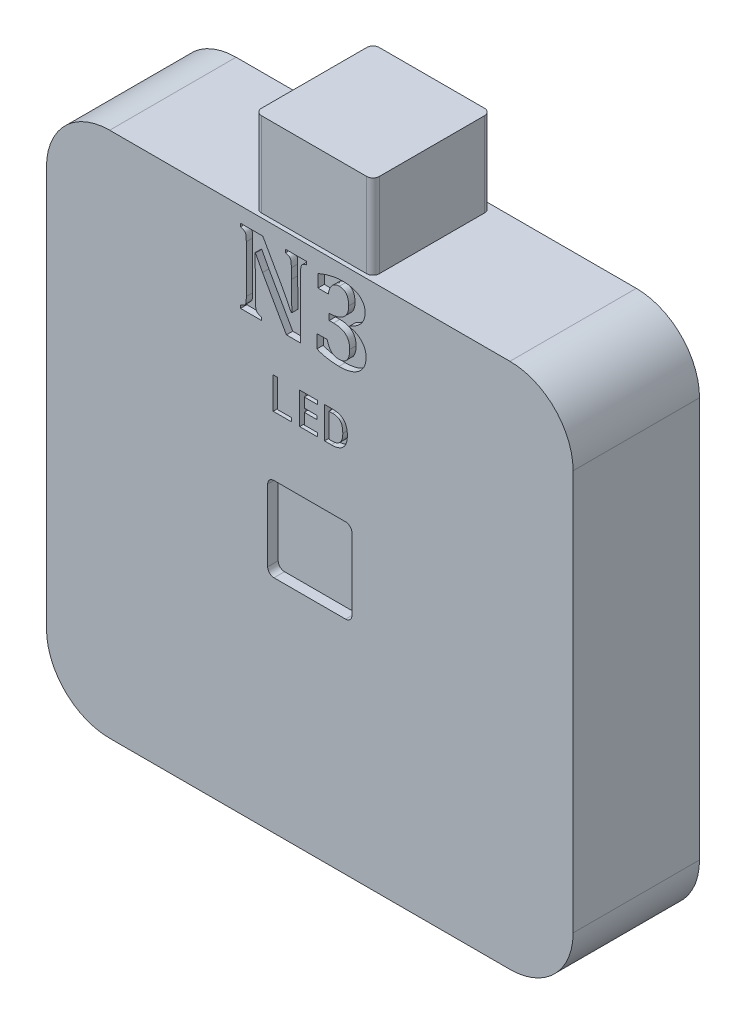
from build123d import *

# Parameters (mm, degrees)
EXTRUDE_1_DEPTH     = 3
CUT_EXTRUDE_2_DEPTH = 0.5
CUT_EXTRUDE_3_DEPTH = 0.3
EXTRUDE_2_DEPTH     = 4
CUT_EXTRUDE_4_DEPTH = 5


with BuildPart() as part:
    # Main → 凸台-拉伸1 (new, symmetric)
    with BuildSketch(Plane.XY):
        with BuildLine():
            Line((-12.5, 9.5), (-12.5, -9.5))
            ThreePointArc((-12.5, -9.5), (-11.621320344, -11.621320344), (-9.5, -12.5))
            Line((-9.5, -12.5), (9.5, -12.5))
            ThreePointArc((9.5, -12.5), (11.621320344, -11.621320344), (12.5, -9.5))
            Line((12.5, -9.5), (12.5, 9.5))
            ThreePointArc((12.5, 9.5), (11.621320344, 11.621320344), (9.5, 12.5))
            Line((9.5, 12.5), (-9.5, 12.5))
            ThreePointArc((-9.5, 12.5), (-11.621320344, 11.621320344), (-12.5, 9.5))
        make_face()
    extrude(amount=EXTRUDE_1_DEPTH, both=True)

    # LED → 切除-拉伸2 (cut)
    with BuildSketch(Plane.XY.offset(3)):
        with BuildLine():
            Line((-2, 1.7), (-2, -1.7))
            ThreePointArc((-2, -1.7), (-1.912132034, -1.912132034), (-1.7, -2))
            Line((-1.7, -2), (1.7, -2))
            ThreePointArc((1.7, -2), (1.912132034, -1.912132034), (2, -1.7))
            Line((2, -1.7), (2, 1.7))
            ThreePointArc((2, 1.7), (1.912132034, 1.912132034), (1.7, 2))
            Line((1.7, 2), (-1.7, 2))
            ThreePointArc((-1.7, 2), (-1.912132034, 1.912132034), (-2, 1.7))
        make_face()
    extrude(amount=-CUT_EXTRUDE_2_DEPTH, mode=Mode.SUBTRACT)

    # 草图3 → 切除-拉伸3 (cut)
    # profile 1 of 5: a face of its own
    with BuildSketch(Plane.XY.offset(3)):
        with BuildLine():
            Line((-0.161653646, 11.781109518), (-0.161653646, 11.635276185))
            add(Edge.make_bspline(
                [(-0.161653646, 11.635276185), (-0.177669577, 11.630143703), (-0.207122243, 11.62070527), (-0.246900488, 11.605079733), (-0.279469724, 11.591737774), (-0.312906932, 11.575932284), (-0.347427448, 11.553100688), (-0.382321405, 11.516267884), (-0.408955266, 11.463747633), (-0.422918392, 11.407823862), (-0.431549055, 11.351158658), (-0.435554473, 11.295811772), (-0.438778121, 11.230222428), (-0.438850306, 11.182844202), (-0.438888889, 11.157520108)],
                knots=[0, 0, 0, 0, 0.975471235, 1.79385316, 2.478592115, 3.017303699, 3.938041953, 4.862988783, 5.927517867, 7.313751775, 8.190433857, 9.251714942, 10.531016607, 12, 12, 12, 12], degree=3))
            Line((-0.438888889, 11.157520108), (-0.438888889, 8.281109518))
            Line((-0.438888889, 8.281109518), (-1.109570312, 8.281109518))
            Line((-1.109570312, 8.281109518), (-2.243576389, 10.276443719))
            add(Edge.make_bspline(
                [(-2.243576389, 10.276443719), (-2.262061977, 10.30935546), (-2.297864844, 10.373098887), (-2.349981257, 10.466014814), (-2.397397164, 10.553857645), (-2.44170538, 10.636006813), (-2.48201379, 10.712701344), (-2.518234642, 10.783968671), (-2.551426649, 10.84954286), (-2.571291416, 10.891884411), (-2.580815972, 10.912185907)],
                knots=[0, 0, 0, 0, 1.258598321, 2.437651948, 3.551981321, 4.586832213, 5.549698172, 6.440681917, 7.252354063, 8, 8, 8, 8], degree=3))
            Line((-2.580815972, 10.912185907), (-2.603602431, 10.912185907))
            add(Edge.make_bspline(
                [(-2.603602431, 10.912185907), (-2.599591716, 10.81800995), (-2.59147488, 10.627417745), (-2.583113042, 10.337504552), (-2.578672736, 10.039985491), (-2.578078581, 9.838945123), (-2.577777778, 9.737164205)],
                knots=[0, 0, 0, 0, 0.96232484, 1.947541814, 2.960899847, 4, 4, 4, 4], degree=3))
            Line((-2.577777778, 9.737164205), (-2.577777778, 8.90317983))
            add(Edge.make_bspline(
                [(-2.577777778, 8.90317983), (-2.577360248, 8.873305826), (-2.576592183, 8.81835119), (-2.574303843, 8.743023002), (-2.568298325, 8.682170292), (-2.558638799, 8.621966077), (-2.535177858, 8.562565398), (-2.499072994, 8.513092269), (-2.457295753, 8.483552474), (-2.414642197, 8.463699144), (-2.361461312, 8.444163617), (-2.321902365, 8.432980934), (-2.300542535, 8.426942851)],
                knots=[0, 0, 0, 0, 1.438978439, 2.647068478, 3.627372042, 4.383140196, 5.576371536, 6.671434312, 7.273846566, 8.020909247, 8.931391092, 10, 10, 10, 10], degree=3))
            Line((-2.300542535, 8.426942851), (-2.300542535, 8.281109518))
            Line((-2.300542535, 8.281109518), (-3.289474826, 8.281109518))
            Line((-3.289474826, 8.281109518), (-3.289474826, 8.426942851))
            add(Edge.make_bspline(
                [(-3.289474826, 8.426942851), (-3.260887566, 8.435405948), (-3.209575028, 8.450596734), (-3.141898216, 8.480225141), (-3.089109373, 8.517166522), (-3.054582463, 8.569155916), (-3.031805913, 8.631573888), (-3.021267721, 8.708155169), (-3.015577407, 8.800531184), (-3.015384102, 8.86822464), (-3.015277778, 8.905458476)],
                knots=[0, 0, 0, 0, 1.149089374, 2.062551405, 2.843955622, 3.594533422, 4.429073491, 5.389328747, 6.564036866, 8, 8, 8, 8], degree=3))
            Line((-3.015277778, 8.905458476), (-3.015277778, 11.15676056))
            add(Edge.make_bspline(
                [(-3.015277778, 11.15676056), (-3.015325243, 11.186892755), (-3.015411829, 11.241859483), (-3.018334, 11.316860805), (-3.023087242, 11.376518256), (-3.032403199, 11.435206702), (-3.054104254, 11.494869379), (-3.091783318, 11.544237582), (-3.134117609, 11.575394999), (-3.176190741, 11.598027263), (-3.229205053, 11.618124618), (-3.268362891, 11.629268152), (-3.289474826, 11.635276185)],
                knots=[0, 0, 0, 0, 1.453211759, 2.650928568, 3.61941141, 4.338124492, 5.512963293, 6.643955544, 7.271627919, 8.036671964, 8.941472357, 10, 10, 10, 10], degree=3))
            Line((-3.289474826, 11.635276185), (-3.289474826, 11.781109518))
            Line((-3.289474826, 11.781109518), (-2.231423611, 11.781109518))
            Line((-2.231423611, 11.781109518), (-1.341232639, 10.204286601))
            add(Edge.make_bspline(
                [(-1.341232639, 10.204286601), (-1.326281235, 10.177203726), (-1.29419107, 10.119075811), (-1.242753958, 10.025182062), (-1.186516622, 9.917693152), (-1.103399271, 9.760024352), (-1.000819197, 9.561493992), (-0.925038386, 9.400153632), (-0.888541667, 9.322450664)],
                knots=[0, 0, 0, 0, 0.561655796, 1.205480602, 1.943652644, 2.764033489, 4.441529425, 6, 6, 6, 6], degree=3))
            Line((-0.888541667, 9.322450664), (-0.84828559, 9.322450664))
            add(Edge.make_bspline(
                [(-0.84828559, 9.322450664), (-0.852568567, 9.42801973), (-0.86132807, 9.643928572), (-0.870286692, 9.974860117), (-0.875728167, 10.319972333), (-0.876165667, 10.554689597), (-0.876388889, 10.674447192)],
                knots=[0, 0, 0, 0, 0.937488971, 1.917343447, 2.937385629, 4, 4, 4, 4], degree=3))
            Line((-0.876388889, 10.674447192), (-0.876388889, 11.156001011))
            add(Edge.make_bspline(
                [(-0.876388889, 11.156001011), (-0.8765491, 11.182077908), (-0.876846263, 11.230445989), (-0.878584804, 11.297370597), (-0.88341317, 11.352551665), (-0.889470731, 11.40804868), (-0.902414163, 11.461838736), (-0.926402611, 11.513437364), (-0.960023933, 11.5513147), (-0.994463834, 11.575841901), (-1.029168865, 11.592604982), (-1.062773812, 11.606857189), (-1.104258254, 11.621111424), (-1.134351907, 11.630312605), (-1.150585937, 11.635276185)],
                knots=[0, 0, 0, 0, 1.50660748, 2.794493175, 3.865833101, 4.705810794, 6.018377177, 7.045366401, 7.95762345, 8.91149549, 9.467497486, 10.181957038, 11.019256184, 12, 12, 12, 12], degree=3))
            Line((-1.150585937, 11.635276185), (-1.150585937, 11.781109518))
            Line((-1.150585937, 11.781109518), (-0.161653646, 11.781109518))
        make_face()
    # profile 2 of 5: a face of its own
    with BuildSketch(Plane.XY.offset(3)):
        with BuildLine():
            Line((0.3875, 10.954720629), (0.3875, 11.55552358))
            add(Edge.make_bspline(
                [(0.3875, 11.55552358), (0.440740019, 11.577509227), (0.544910562, 11.620526806), (0.701382153, 11.67600796), (0.853924181, 11.723162671), (1.002588814, 11.762188687), (1.147644136, 11.791995458), (1.288859262, 11.813238903), (1.426551741, 11.826815623), (1.517172623, 11.82876262), (1.561762153, 11.829720629)],
                knots=[0, 0, 0, 0, 1.138871734, 2.228340433, 3.281437788, 4.295392059, 5.266464412, 6.20817041, 7.11833965, 8, 8, 8, 8], degree=3))
            add(Edge.make_bspline(
                [(1.561762153, 11.829720629), (1.612700862, 11.828818436), (1.711831349, 11.827062702), (1.855946997, 11.810043084), (1.991078637, 11.782324938), (2.116218264, 11.742896491), (2.230784195, 11.693991601), (2.332778472, 11.634502441), (2.419627815, 11.562468262), (2.493671249, 11.481886216), (2.55197375, 11.390384121), (2.594306505, 11.289862871), (2.619025084, 11.17971571), (2.62204951, 11.103465747), (2.623611111, 11.064095629)],
                knots=[0, 0, 0, 0, 1.245991689, 2.424791773, 3.545045706, 4.616816666, 5.629595787, 6.587952593, 7.494614438, 8.380594144, 9.255347842, 10.135547138, 11.037327689, 12, 12, 12, 12], degree=3))
            add(Edge.make_bspline(
                [(2.623611111, 11.064095629), (2.622735968, 11.028066694), (2.621031018, 10.957875282), (2.60351275, 10.856007142), (2.57681259, 10.760264172), (2.537203389, 10.67174744), (2.48900985, 10.589026607), (2.431899461, 10.51188363), (2.364854414, 10.440894183), (2.289034787, 10.374315574), (2.202470426, 10.311815885), (2.105401044, 10.250288114), (1.996821144, 10.188580227), (1.91897061, 10.150440372), (1.878493924, 10.130610386)],
                knots=[0, 0, 0, 0, 1.018223358, 1.983698243, 2.915322269, 3.82284993, 4.718315375, 5.619291428, 6.531357531, 7.475260989, 8.469397413, 9.548207294, 10.725243872, 12, 12, 12, 12], degree=3))
            Line((1.878493924, 10.130610386), (1.878493924, 10.107823928))
            add(Edge.make_bspline(
                [(1.878493924, 10.107823928), (1.914332461, 10.100573361), (1.985268492, 10.086222149), (2.088345737, 10.054417236), (2.185825078, 10.011929471), (2.278699343, 9.962321579), (2.364496749, 9.903470268), (2.441580147, 9.834864416), (2.509481243, 9.757209764), (2.567266491, 9.670081548), (2.614853742, 9.575293169), (2.648343733, 9.472147921), (2.668374432, 9.361713423), (2.670917252, 9.285571619), (2.672222222, 9.246495803)],
                knots=[0, 0, 0, 0, 1.026010526, 2.030805963, 3.020916541, 4.0067071, 4.98253303, 5.933933234, 6.895997563, 7.869724968, 8.861364754, 9.863719257, 10.903665134, 12, 12, 12, 12], degree=3))
            add(Edge.make_bspline(
                [(2.672222222, 9.246495803), (2.670475833, 9.198772508), (2.66704771, 9.105092709), (2.639892184, 8.96867947), (2.594916044, 8.840381305), (2.541926714, 8.741209427), (2.491221993, 8.666758497), (2.448082435, 8.614099673), (2.400660821, 8.563973017), (2.347753383, 8.517937264), (2.291156171, 8.473615925), (2.229135573, 8.433475264), (2.162916446, 8.396210352), (2.067455524, 8.350000016), (1.936808858, 8.301935023), (1.766553096, 8.261373754), (1.580692314, 8.237026181), (1.451703991, 8.234044991), (1.384787326, 8.232498407)],
                knots=[0, 0, 0, 0, 1.238691166, 2.431524098, 3.596131476, 4.758044184, 5.339846471, 5.93341988, 6.524072501, 7.129652346, 7.75306838, 8.389559096, 9.046112197, 9.725450149, 11.142277535, 12.650970423, 14.262587788, 16, 16, 16, 16], degree=3))
            add(Edge.make_bspline(
                [(1.384787326, 8.232498407), (1.33716922, 8.233000944), (1.242335341, 8.234001772), (1.100704382, 8.244589066), (0.960201974, 8.260012504), (0.822458508, 8.283105417), (0.689307329, 8.310166445), (0.564478721, 8.345095257), (0.447273325, 8.381722131), (0.374357917, 8.413166248), (0.338888889, 8.428461949)],
                knots=[0, 0, 0, 0, 1.066585531, 2.124159315, 3.180226203, 4.232065357, 5.252166273, 6.22223498, 7.135222593, 8, 8, 8, 8], degree=3))
            Line((0.338888889, 8.428461949), (0.338888889, 9.058887296))
            Line((0.338888889, 9.058887296), (0.825, 9.058887296))
            add(Edge.make_bspline(
                [(0.825, 9.058887296), (0.837189747, 9.015014079), (0.860202393, 8.932187192), (0.907565053, 8.819827773), (0.960730451, 8.725473619), (1.023417455, 8.650027003), (1.096067092, 8.592546026), (1.17921829, 8.55307138), (1.27189704, 8.527622129), (1.337265875, 8.52534449), (1.371115451, 8.524165074)],
                knots=[0, 0, 0, 0, 1.305930177, 2.46542516, 3.491309853, 4.404185451, 5.263440125, 6.128056862, 7.030662191, 8, 8, 8, 8], degree=3))
            add(Edge.make_bspline(
                [(1.371115451, 8.524165074), (1.392164121, 8.524433805), (1.433176166, 8.524957413), (1.492609065, 8.53390272), (1.548059007, 8.546568938), (1.599916425, 8.563781846), (1.646929411, 8.587859054), (1.690785253, 8.615684602), (1.729796272, 8.649783266), (1.765072714, 8.688559859), (1.795252278, 8.733144058), (1.822079278, 8.782170178), (1.84498521, 8.836294062), (1.86284081, 8.89598753), (1.877484799, 8.960655912), (1.886829861, 9.030567503), (1.893110212, 9.1053591), (1.893990014, 9.156854944), (1.894444444, 9.183453268)],
                knots=[0, 0, 0, 0, 1.04932923, 2.044553753, 2.991534269, 3.886518749, 4.762302477, 5.620875306, 6.471885114, 7.33961212, 8.229767994, 9.151377203, 10.125200033, 11.156267991, 12.256683227, 13.430583075, 14.672860224, 16, 16, 16, 16], degree=3))
            add(Edge.make_bspline(
                [(1.894444444, 9.183453268), (1.893923242, 9.212094329), (1.89291031, 9.267756915), (1.883337619, 9.348187978), (1.86974041, 9.423238576), (1.847881869, 9.491942686), (1.821530947, 9.555576976), (1.788878631, 9.613655138), (1.749657985, 9.66586494), (1.704456283, 9.71249025), (1.653392593, 9.753918462), (1.595481177, 9.788663397), (1.532454678, 9.819445748), (1.462480649, 9.84356268), (1.386682245, 9.862203917), (1.304717529, 9.876142531), (1.216545131, 9.883216945), (1.155667314, 9.884575397), (1.124262153, 9.885276185)],
                knots=[0, 0, 0, 0, 1.148071931, 2.231225072, 3.24480356, 4.201827953, 5.116438562, 6.003060875, 6.866114256, 7.727792825, 8.601530905, 9.494871905, 10.430378815, 11.409816751, 12.456422708, 13.558120058, 14.740302521, 16, 16, 16, 16], degree=3))
            Line((1.124262153, 9.885276185), (0.922222222, 9.885276185))
            Line((0.922222222, 9.885276185), (0.922222222, 10.176942851))
            add(Edge.make_bspline(
                [(0.922222222, 10.176942851), (0.958968977, 10.179047578), (1.030367567, 10.183137041), (1.133861524, 10.196149192), (1.23055265, 10.214228929), (1.320626575, 10.237464771), (1.403485769, 10.267000531), (1.479437046, 10.302240842), (1.548758592, 10.342427601), (1.611744672, 10.387864156), (1.666592564, 10.440159976), (1.714960843, 10.497177798), (1.755313557, 10.560217187), (1.789037602, 10.628097219), (1.814991128, 10.701808441), (1.832889709, 10.780828418), (1.84365028, 10.865304662), (1.845090515, 10.92329325), (1.845833333, 10.953201532)],
                knots=[0, 0, 0, 0, 1.294124326, 2.514471056, 3.665273782, 4.75157949, 5.782351101, 6.754339568, 7.691995305, 8.596689159, 9.478484644, 10.35060716, 11.219952716, 12.103948147, 13.010742687, 13.961079669, 14.948403386, 16, 16, 16, 16], degree=3))
            add(Edge.make_bspline(
                [(1.845833333, 10.953201532), (1.845601673, 10.976502984), (1.845150288, 11.021905495), (1.839954798, 11.087649363), (1.83057941, 11.148966268), (1.818822186, 11.205961214), (1.803003196, 11.258682836), (1.782835695, 11.306707618), (1.760733292, 11.351079808), (1.73337706, 11.389994358), (1.704254924, 11.425255015), (1.670709149, 11.455221946), (1.634583481, 11.481320037), (1.594305126, 11.501550057), (1.551844133, 11.518784688), (1.505510174, 11.529871196), (1.456147632, 11.536840966), (1.422030494, 11.537642794), (1.40453559, 11.538053962)],
                knots=[0, 0, 0, 0, 1.342415624, 2.615675512, 3.795773904, 4.914495864, 5.966655767, 6.960891649, 7.913479791, 8.815817395, 9.695585522, 10.542445334, 11.400538855, 12.255277765, 13.132987386, 14.03520706, 14.992475158, 16, 16, 16, 16], degree=3))
            add(Edge.make_bspline(
                [(1.40453559, 11.538053962), (1.384491939, 11.53754342), (1.344910756, 11.536535226), (1.286744903, 11.526292289), (1.230852682, 11.509562789), (1.177220657, 11.485709854), (1.12508323, 11.454589705), (1.077488635, 11.411845023), (1.032105503, 11.360106931), (0.989775583, 11.298597965), (0.951803541, 11.227101967), (0.920110747, 11.145095851), (0.892637928, 11.053754417), (0.880107507, 10.9885341), (0.873611111, 10.954720629)],
                knots=[0, 0, 0, 0, 0.831492998, 1.641990067, 2.443438678, 3.248189408, 4.073881454, 4.952981561, 5.891417605, 6.926545987, 8.045740153, 9.244265423, 10.571289508, 12, 12, 12, 12], degree=3))
            Line((0.873611111, 10.954720629), (0.3875, 10.954720629))
        make_face()
    # profile 3 of 5: a face of its own
    with BuildSketch(Plane.XY.offset(3)):
        Polygon((-0.869565217, 4.825678085), (-1.739130435, 4.825678085), (-1.739130435, 6.325678085), (-1.52173913, 6.325678085), (-1.52173913, 4.999591128), (-0.869565217, 4.999591128), align=None)
    # profile 4 of 5: a face of its own
    with BuildSketch(Plane.XY.offset(3)):
        Polygon((0.369565217, 4.825678085), (-0.47826087, 4.825678085), (-0.47826087, 6.325678085), (0.369565217, 6.325678085), (0.369565217, 6.151765041), (-0.260869565, 6.151765041), (-0.260869565, 5.695243302), (0.344429348, 5.695243302), (0.344429348, 5.521330259), (-0.260869565, 5.521330259), (-0.260869565, 4.999591128), (0.369565217, 4.999591128), align=None)
    # profile 5 of 5: a face of its own
    with BuildSketch(Plane.XY.offset(3)):
        with BuildLine():
            add(Edge.make_bspline(
                [(1.782608696, 5.592322107), (1.781881693, 5.557071296), (1.780453249, 5.487809132), (1.769639022, 5.402697551), (1.757030821, 5.337344625), (1.744778972, 5.290636145), (1.730148703, 5.245451149), (1.712869427, 5.202118691), (1.693087326, 5.160443807), (1.670777532, 5.120529234), (1.645105156, 5.082959727), (1.617340404, 5.046999069), (1.586239261, 5.013529079), (1.55176278, 4.982547568), (1.513983946, 4.953939128), (1.472709687, 4.928053631), (1.428019143, 4.905147805), (1.380326169, 4.884093241), (1.328856141, 4.866699984), (1.273999358, 4.851672582), (1.215487151, 4.839669642), (1.153019868, 4.83187259), (1.086821989, 4.826554805), (1.041338254, 4.825975367), (1.018002717, 4.825678085)],
                knots=[0, 0, 0, 0, 1.874627119, 3.68334034, 4.55511198, 5.414139205, 6.25033141, 7.080252411, 7.893905149, 8.703019486, 9.509911256, 10.312362027, 11.117881282, 11.936734267, 12.775179546, 13.635831221, 14.524848569, 15.444673208, 16.406604644, 17.411911457, 18.469143348, 19.580838344, 20.758843452, 22, 22, 22, 22], degree=3))
            Line((1.018002717, 4.825678085), (0.695652174, 4.825678085))
            Line((0.695652174, 4.825678085), (0.695652174, 6.325678085))
            Line((0.695652174, 6.325678085), (1.083559783, 6.325678085))
            add(Edge.make_bspline(
                [(1.083559783, 6.325678085), (1.112000472, 6.325210637), (1.167205562, 6.324303293), (1.247203115, 6.315771362), (1.321614986, 6.30153098), (1.390592594, 6.282111252), (1.453838666, 6.256436711), (1.511742055, 6.225622096), (1.563859575, 6.188578649), (1.610414006, 6.145786933), (1.651504473, 6.097246892), (1.686641012, 6.042511604), (1.716612678, 5.982038736), (1.741038601, 5.915527283), (1.759476359, 5.842962668), (1.772951489, 5.764723032), (1.781180102, 5.680473029), (1.782122124, 5.622345867), (1.782608696, 5.592322107)],
                knots=[0, 0, 0, 0, 1.17177347, 2.274482801, 3.310388109, 4.291013938, 5.222472681, 6.118087065, 6.988127256, 7.850034114, 8.717518086, 9.601485366, 10.523818561, 11.493740021, 12.515690363, 13.604990885, 14.762933224, 16, 16, 16, 16], degree=3))
        make_face()
        with BuildLine():
            add(Edge.make_bspline(
                [(1.565217391, 5.574998737), (1.564942283, 5.600597445), (1.564413293, 5.649819846), (1.559006206, 5.72050339), (1.549966202, 5.785095837), (1.537269437, 5.843787056), (1.520513695, 5.896701404), (1.500812547, 5.944568744), (1.476103757, 5.986462703), (1.448035269, 6.023535183), (1.41582989, 6.055206124), (1.37998254, 6.082555478), (1.340199693, 6.104942915), (1.296431336, 6.122241928), (1.249111655, 6.135293061), (1.1980606, 6.145365053), (1.142879255, 6.150452204), (1.104854455, 6.15131856), (1.085258152, 6.151765041)],
                knots=[0, 0, 0, 0, 1.413547595, 2.71803587, 3.911871408, 5.013341294, 6.029850817, 6.974090411, 7.865305992, 8.708270035, 9.535123508, 10.351794371, 11.191784495, 12.047569406, 12.944296091, 13.8996306, 14.91756238, 16, 16, 16, 16], degree=3))
            Line((1.085258152, 6.151765041), (0.913043478, 6.151765041))
            Line((0.913043478, 6.151765041), (0.913043478, 4.999591128))
            Line((0.913043478, 4.999591128), (1.062839674, 4.999591128))
            add(Edge.make_bspline(
                [(1.062839674, 4.999591128), (1.083119777, 5.000098955), (1.122540429, 5.001086073), (1.179823302, 5.007233415), (1.232969226, 5.018977041), (1.282313121, 5.034521063), (1.327867865, 5.054457277), (1.369231205, 5.079585621), (1.407048253, 5.108823381), (1.44029475, 5.143228176), (1.470310154, 5.181482487), (1.49564387, 5.224719414), (1.517491997, 5.272122957), (1.535090611, 5.324060024), (1.548537836, 5.380487759), (1.558324612, 5.441335212), (1.564040428, 5.506728193), (1.564817043, 5.551776255), (1.565217391, 5.574998737)],
                knots=[0, 0, 0, 0, 1.112402768, 2.162298815, 3.153767855, 4.092494856, 4.996014567, 5.873553179, 6.740614794, 7.610074679, 8.4907496, 9.401305331, 10.351566166, 11.349161427, 12.403455731, 13.529502205, 14.72644707, 16, 16, 16, 16], degree=3))
        make_face(mode=Mode.SUBTRACT)
    extrude(amount=-CUT_EXTRUDE_3_DEPTH, mode=Mode.SUBTRACT)

    # 草图4 → 凸台-拉伸2 (add)
    with BuildSketch(Plane(origin=(0, 12.5, 0), x_dir=(1, 0, 0), z_dir=(0, 1, 0))):
        with BuildLine():
            Line((-2.5, 2.8), (2.5, 2.8))
            ThreePointArc((2.5, 2.8), (2.712132034, 2.712132034), (2.8, 2.5))
            Line((2.8, 2.5), (2.8, -2.5))
            ThreePointArc((2.8, -2.5), (2.712132034, -2.712132034), (2.5, -2.8))
            Line((2.5, -2.8), (-2.5, -2.8))
            ThreePointArc((-2.5, -2.8), (-2.712132034, -2.712132034), (-2.8, -2.5))
            Line((-2.8, -2.5), (-2.8, 2.5))
            ThreePointArc((-2.8, 2.5), (-2.712132034, 2.712132034), (-2.5, 2.8))
        make_face()
    extrude(amount=EXTRUDE_2_DEPTH)

    # 草图5 → 切除-拉伸4 (cut)
    with BuildSketch(Plane.XZ.offset(12.5)):
        Polygon((-3.25, -0.8), (3.25, -0.8), (3.25, 0), (2.5, 1.2), (-2.5, 1.2), (-3.25, 0), align=None)
    extrude(amount=-CUT_EXTRUDE_4_DEPTH, mode=Mode.SUBTRACT)


solid = part.part
